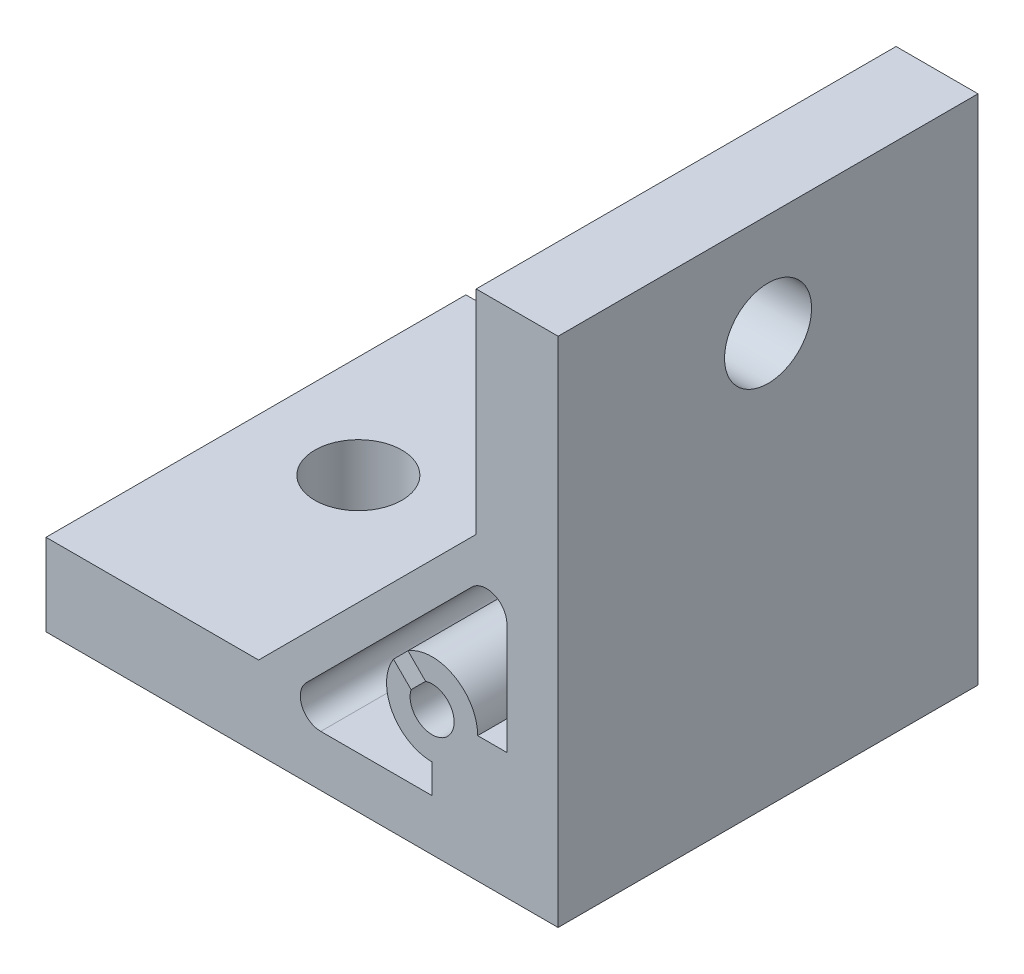
from build123d import *

# Parameters (mm, degrees)
EXTRUDE_1_DEPTH     = 20.5
SKETCH_3_R          = 4.25
CUT_EXTRUDE_1_DEPTH = 69.441580929


with BuildPart() as part:
    # 草图1 → 凸台-拉伸1 (new, symmetric)
    with BuildSketch(Plane.XY):
        Polygon((0, 0), (50, 0), (50, 50), (42, 50), (42, 29.242640687), (20.757359313, 8), (0, 8), align=None)
        with BuildLine():
            Line((37.061279898, 14.352933665), (35.340960992, 16.07325257))
            ThreePointArc((35.340960992, 16.07325257), (39.856939547, 16.192314452), (42.15, 12.3))
            Line((42.15, 12.3), (45, 12.3))
            Line((45, 12.3), (45, 23.171572875))
            ThreePointArc((45, 23.171572875), (43.765366865, 25.01933194), (41.585786438, 24.585786438))
            Line((41.585786438, 24.585786438), (25.414213562, 8.414213562))
            ThreePointArc((25.414213562, 8.414213562), (24.98066806, 6.234633135), (26.828427125, 5))
            Line((26.828427125, 5), (37.7, 5))
            Line((37.7, 5), (37.7, 7.85))
            ThreePointArc((37.7, 7.85), (33.807685548, 10.143060453), (33.92674743, 14.659039008))
            Line((33.92674743, 14.659039008), (35.647066335, 12.938720102))
            ThreePointArc((35.647066335, 12.938720102), (39.22027958, 10.77972042), (37.061279898, 14.352933665))
        make_face(mode=Mode.SUBTRACT)
    extrude(amount=EXTRUDE_1_DEPTH, both=True)

    # 草图3 → 切除-拉伸1 (cut, through all)
    with BuildSketch(Plane(origin=(0, 8, 0), x_dir=(1, 0, 0), z_dir=(0, 1, 0))):
        with Locations(Location((10, 0, 0), (0, 0, 270))):
            Circle(SKETCH_3_R)
    cut_extrude_1 = extrude(amount=-CUT_EXTRUDE_1_DEPTH, mode=Mode.SUBTRACT)

    # 镜向1: 切除-拉伸1 across plane
    add(cut_extrude_1.mirror(Plane(origin=(25, 25, 0), x_dir=(0, 0, 1), z_dir=(-0.7071067811865485, -0.7071067811865467, 0))), mode=Mode.SUBTRACT)


solid = part.part
